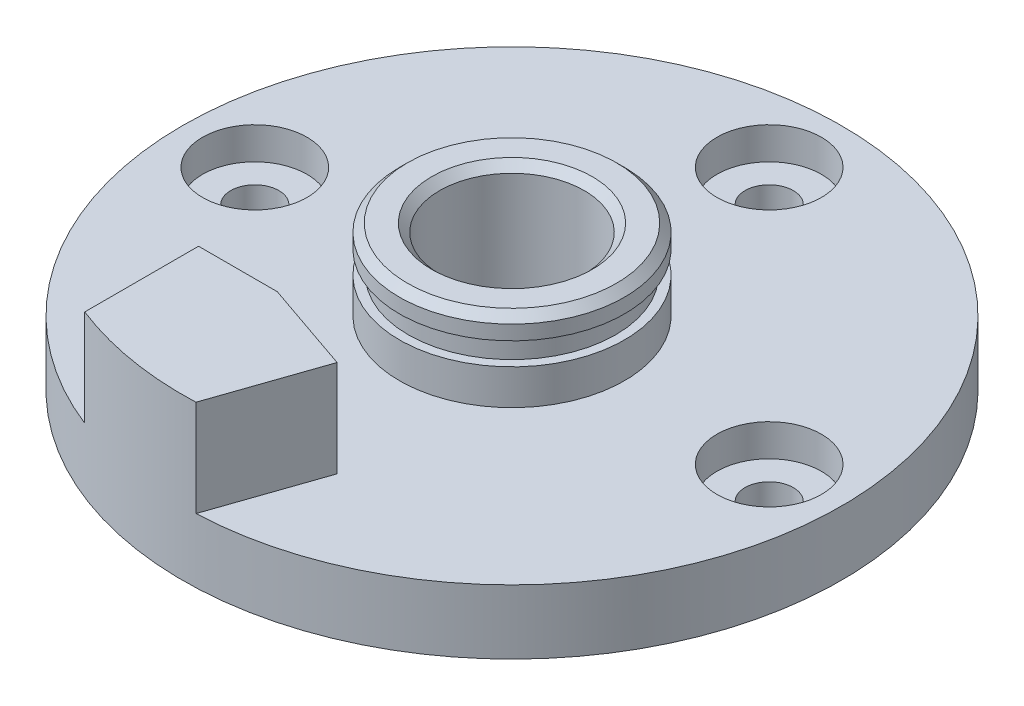
from build123d import *

# Parameters (mm, degrees)
SKETCH_2_R          = 1.5
CUT_EXTRUDE_1_DEPTH = 31.356218473
CUT_EXTRUDE_START   = 4
SKETCH_3_R          = 3.25
CUT_EXTRUDE_2_DEPTH = 2
EXTRUDE_START       = 6
EXTRUDE_1_DEPTH     = 6
SKETCH_5_R          = 7.5
CUT_EXTRUDE_3_DEPTH = 1
CHAMFER_1_SIZE      = 0.5
CHAMFER_2_SIZE      = 0.5
CUT_EXTRUDE_4_DEPTH = 6
EXTRUDE_2_DEPTH     = 6


with BuildPart() as part:
    # 草图1 → 旋转1 (revolve)
    with BuildSketch(Plane.XY):
        Polygon((-4.5, 0), (-20.5, 0), (-20.5, 4), (-7, 4), (-7, 6.2), (-6.45, 6.2), (-6.45, 7.6), (-7, 7.6), (-7, 9), (-4.5, 9), align=None)
    revolve(axis=Axis((0, 7, 0), (0, -1, 0)))

    # 草图2 → 切除-拉伸1 (cut, through all)
    with BuildSketch(Plane(origin=(0, 0, 0), x_dir=(1, 0, 0), z_dir=(0, 1, 0))):
        with Locations(Location((-16, 0, 0), (0, 0, 180))):
            Circle(SKETCH_2_R)
        with Locations(Location((0, 16, 0), (0, 0, 180))):
            Circle(SKETCH_2_R)
        with Locations(Location((16, 0, 0), (0, 0, 180))):
            Circle(SKETCH_2_R)
    extrude(amount=CUT_EXTRUDE_1_DEPTH, mode=Mode.SUBTRACT)

    # 草图3 → 切除-拉伸2 (cut)
    with BuildSketch(Plane(origin=(0, 0, 0), x_dir=(1, 0, 0), z_dir=(0, 1, 0)).offset(CUT_EXTRUDE_START)):
        with Locations(Location((-16, 0, 0), (0, 0, 180))):
            Circle(SKETCH_3_R)
        with Locations(Location((0, 16, 0), (0, 0, 180))):
            Circle(SKETCH_3_R)
        with Locations(Location((16, 0, 0), (0, 0, 180))):
            Circle(SKETCH_3_R)
    extrude(amount=-CUT_EXTRUDE_2_DEPTH, mode=Mode.SUBTRACT)

    # 草图4 → 凸台-拉伸1 (add)
    with BuildSketch(Plane(origin=(0, 4, 0), x_dir=(1, 0, 0), z_dir=(0, 1, 0)).offset(EXTRUDE_START)):
        with BuildLine():
            Line((7.5, -12), (-7.5, -12))
            Line((-7.5, -12), (-7.5, -19.078784028))
            ThreePointArc((-7.5, -19.078784028), (0, -20.5), (7.5, -19.078784028))
            Line((7.5, -19.078784028), (7.5, -12))
        make_face()
    extrude(amount=-EXTRUDE_1_DEPTH)

    # 草图5 → 切除-拉伸3 (cut)
    with BuildSketch(Plane.XZ):
        Circle(SKETCH_5_R)
    extrude(amount=-CUT_EXTRUDE_3_DEPTH, mode=Mode.SUBTRACT)

    # 倒角1
    chamfer_1_edges = [part.edges().sort_by_distance(p)[0] for p in [
        (4.5, 1, 0),
        (4.5, 9, 0),
    ]]
    chamfer(chamfer_1_edges, length=CHAMFER_1_SIZE)

    # 倒角2
    chamfer_2_edges = [part.edges().sort_by_distance(p)[0] for p in [
        (7, 9, 0),
    ]]
    chamfer(chamfer_2_edges, length=CHAMFER_2_SIZE)

    # 草图6 → 切除-拉伸4 (cut)
    with BuildSketch(Plane(origin=(0, 10, 0), x_dir=(1, 0, 0), z_dir=(0, 1, 0))):
        Polygon((1.967727288, -14.033683215), (-1.353682174, -21.493691009), (7.5, -20.908921831), (7.5, -12), (-2.6, -12), align=None)
    extrude(amount=-CUT_EXTRUDE_4_DEPTH, mode=Mode.SUBTRACT)

    # 草图7 → 凸台-拉伸2 (add)
    with BuildSketch(Plane(origin=(0, 4, 0), x_dir=(1, 0, 0), z_dir=(0, 1, 0)).offset(EXTRUDE_START)):
        with BuildLine():
            Line((-2.6, -12), (3.073111454, -13.953408927))
            Line((3.073111454, -13.953408927), (0.824652926, -20.483406639))
            ThreePointArc((0.824652926, -20.483406639), (-0.038915526, -20.499963063), (-0.902414897, -20.480128109))
            Line((-0.902414897, -20.480128109), (1.967727288, -14.033683215))
            Line((1.967727288, -14.033683215), (-2.6, -12))
        make_face()
    extrude(amount=-EXTRUDE_2_DEPTH)


solid = part.part
